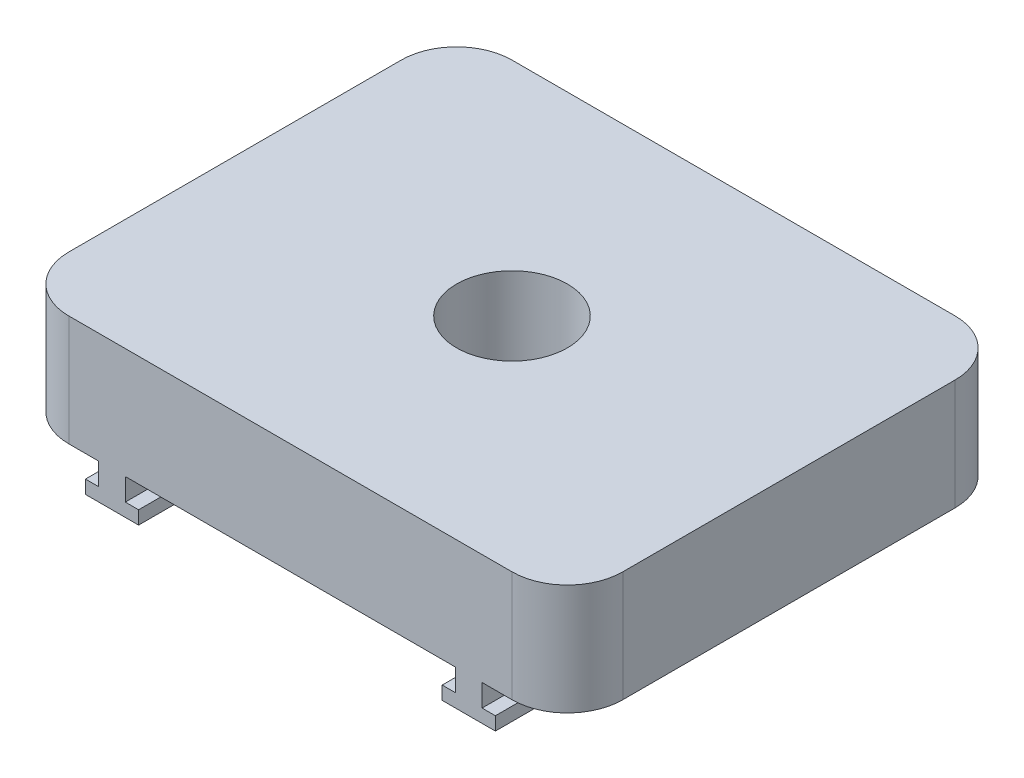
from build123d import *

# Parameters (mm, degrees)
SKETCH_1_W          = 370
SKETCH_1_H          = 400
EXTRUDE_1_DEPTH     = 132
SKETCH_2_W          = 12
SKETCH_2_H          = 119.999999988
CUT_EXTRUDE_1_DEPTH = 449.273354104
SKETCH_3_W          = 400
SKETCH_3_H          = 100
EXTRUDE_2_DEPTH     = 77
SKETCH_4_W          = 12
SKETCH_4_H          = 119.999999988
CUT_EXTRUDE_2_DEPTH = 479.773432847
SKETCH_5_W          = 400
SKETCH_5_H          = 100
EXTRUDE_3_DEPTH     = 77
CUT_EXTRUDE_3_DEPTH = 479.773432847
HOLE_WIZARD_1_D     = 100
FILLET_1_R          = 50


with BuildPart() as part:
    # 草图1 → 凸台-拉伸1 (new body)
    with BuildSketch(Plane.XZ.offset(82)):
        Rectangle(SKETCH_1_W, SKETCH_1_H)
    extrude(amount=-EXTRUDE_1_DEPTH)

    # 草图2 → 切除-拉伸1 (cut, through all)
    with BuildSketch(Plane.XY.offset(200)):
        with Locations((-179, -9.999999994)):
            Rectangle(SKETCH_2_W, SKETCH_2_H)
    extrude(amount=-CUT_EXTRUDE_1_DEPTH, mode=Mode.SUBTRACT)

    # 草图3 → 凸台-拉伸2 (add)
    with BuildSketch(Plane.ZY.offset(173)):
        Rectangle(SKETCH_3_W, SKETCH_3_H)
    extrude(amount=EXTRUDE_2_DEPTH)

    # 草图4 → 切除-拉伸2 (cut, through all)
    with BuildSketch(Plane.XY.offset(200)):
        with Locations((179, -9.999999994)):
            Rectangle(SKETCH_4_W, SKETCH_4_H)
    extrude(amount=-CUT_EXTRUDE_2_DEPTH, mode=Mode.SUBTRACT)

    # 草图5 → 凸台-拉伸3 (add)
    with BuildSketch(Plane(origin=(173, 0, 0), x_dir=(0, 0, -1), z_dir=(1, 0, 0))):
        Rectangle(SKETCH_5_W, SKETCH_5_H)
    extrude(amount=EXTRUDE_3_DEPTH)

    # 草图6 → 切除-拉伸3 (cut, through all)
    with BuildSketch(Plane(origin=(0, 0, -200), x_dir=(-1, 0, 0), z_dir=(0, 0, -1))):
        Polygon((-137, -82), (137, -82), (137, -69.999999997), (149, -69.999999997), (149, -50), (-149, -50), (-149, -69.999999997), (-137, -69.999999997), align=None)
    extrude(amount=-CUT_EXTRUDE_3_DEPTH, mode=Mode.SUBTRACT)

    # 孔1 (through all)
    with Locations(Plane(origin=(0, -50, 0), x_dir=(-1, 0, 0), z_dir=(0, -1, 0))):
        with Locations((0, 0)):
            Hole(HOLE_WIZARD_1_D / 2)

    # 圆角1
    fillet_1_edges = [part.edges().sort_by_distance(p)[0] for p in [
        (-250, 0, -200),
        (-250, 0, 200),
        (250, 0, -200),
        (250, 0, 200),
    ]]
    fillet(fillet_1_edges, radius=FILLET_1_R)


solid = part.part
